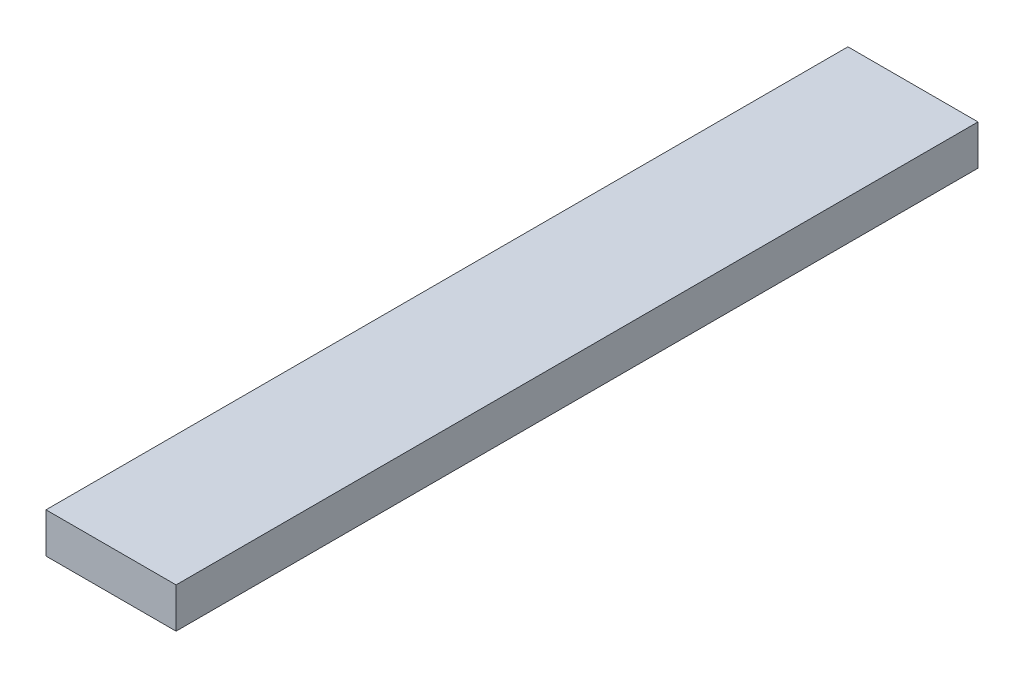
from build123d import *

# Parameters (mm, degrees)
SKETCH1_W           = 20.6
SKETCH1_H           = 127
BOSS_EXTRUDE1_DEPTH = 6.35


with BuildPart() as part:
    # Sketch1 → Boss-Extrude1 (new body)
    with BuildSketch(Plane(origin=(0, 0, 0), x_dir=(1, 0, 0), z_dir=(0, 1, 0))):
        with Locations((10.3, -63.5)):
            Rectangle(SKETCH1_W, SKETCH1_H)
    extrude(amount=BOSS_EXTRUDE1_DEPTH)


solid = part.part
